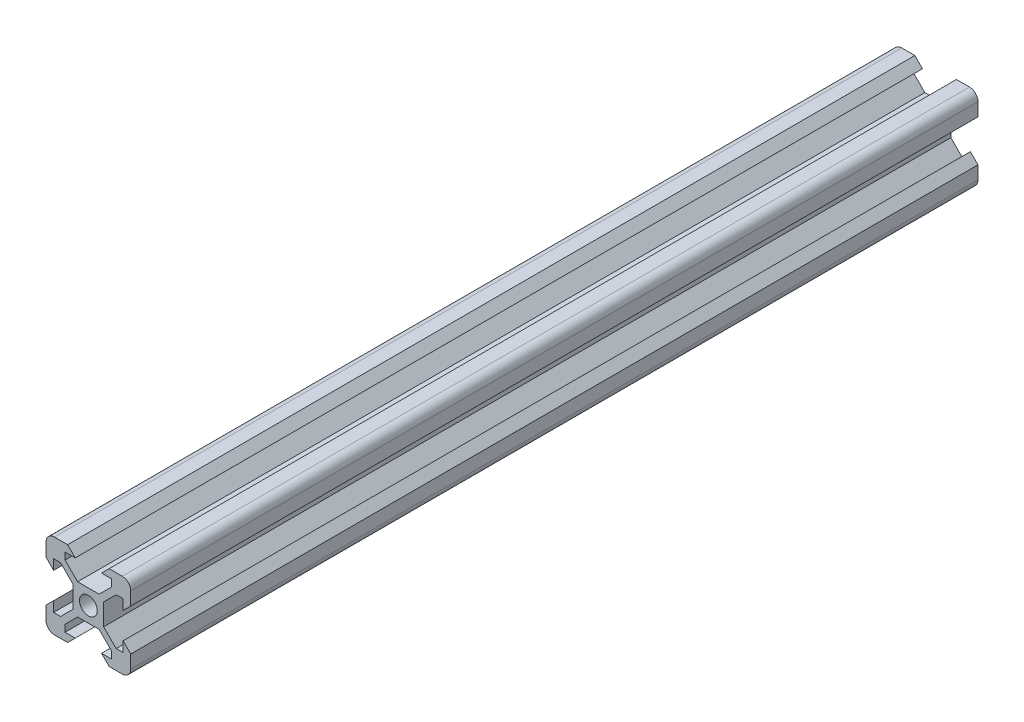
from build123d import *

# Parameters (mm, degrees)
SKETCH1_R           = 2.1
BOSS_EXTRUDE1_DEPTH = 200


with BuildPart() as part:
    # Sketch1 → Boss-Extrude1 (new body)
    with BuildSketch(Plane.XY):
        with BuildLine():
            Line((-4.9, -10), (-3.1, -8.2))
            Line((-3.1, -8.2), (-5.5, -8.2))
            Line((-5.5, -8.2), (-5.5, -6.560660172))
            Line((-5.5, -6.560660172), (-2.539339828, -3.6))
            Line((-2.539339828, -3.6), (2.539339828, -3.6))
            Line((2.539339828, -3.6), (5.5, -6.560660172))
            Line((5.5, -6.560660172), (5.5, -8.2))
            Line((5.5, -8.2), (3.1, -8.2))
            Line((3.1, -8.2), (4.9, -10))
            Line((4.9, -10), (8, -10))
            ThreePointArc((8, -10), (9.414213562, -9.414213562), (10, -8))
            Line((10, -8), (10, -4.9))
            Line((10, -4.9), (8.2, -3.1))
            Line((8.2, -3.1), (8.2, -5.5))
            Line((8.2, -5.5), (6.560660172, -5.5))
            Line((6.560660172, -5.5), (3.6, -2.539339828))
            Line((3.6, -2.539339828), (3.6, 2.539339828))
            Line((3.6, 2.539339828), (6.560660172, 5.5))
            Line((6.560660172, 5.5), (8.2, 5.5))
            Line((8.2, 5.5), (8.2, 3.1))
            Line((8.2, 3.1), (10, 4.9))
            Line((10, 4.9), (10, 8))
            ThreePointArc((10, 8), (9.414213562, 9.414213562), (8, 10))
            Line((8, 10), (4.9, 10))
            Line((4.9, 10), (3.1, 8.2))
            Line((3.1, 8.2), (5.5, 8.2))
            Line((5.5, 8.2), (5.5, 6.560660172))
            Line((5.5, 6.560660172), (2.539339828, 3.6))
            Line((2.539339828, 3.6), (-2.539339828, 3.6))
            Line((-2.539339828, 3.6), (-5.5, 6.560660172))
            Line((-5.5, 6.560660172), (-5.5, 8.2))
            Line((-5.5, 8.2), (-3.1, 8.2))
            Line((-3.1, 8.2), (-4.9, 10))
            Line((-4.9, 10), (-8, 10))
            ThreePointArc((-8, 10), (-9.414213562, 9.414213562), (-10, 8))
            Line((-10, 8), (-10, 4.9))
            Line((-10, 4.9), (-8.2, 3.1))
            Line((-8.2, 3.1), (-8.2, 5.5))
            Line((-8.2, 5.5), (-6.560660172, 5.5))
            Line((-6.560660172, 5.5), (-3.6, 2.539339828))
            Line((-3.6, 2.539339828), (-3.6, -2.539339828))
            Line((-3.6, -2.539339828), (-6.560660172, -5.5))
            Line((-6.560660172, -5.5), (-8.2, -5.5))
            Line((-8.2, -5.5), (-8.2, -3.1))
            Line((-8.2, -3.1), (-10, -4.9))
            Line((-10, -4.9), (-10, -8))
            ThreePointArc((-10, -8), (-9.414213562, -9.414213562), (-8, -10))
            Line((-8, -10), (-4.9, -10))
        make_face()
        Circle(SKETCH1_R, mode=Mode.SUBTRACT)
    extrude(amount=BOSS_EXTRUDE1_DEPTH)


solid = part.part
